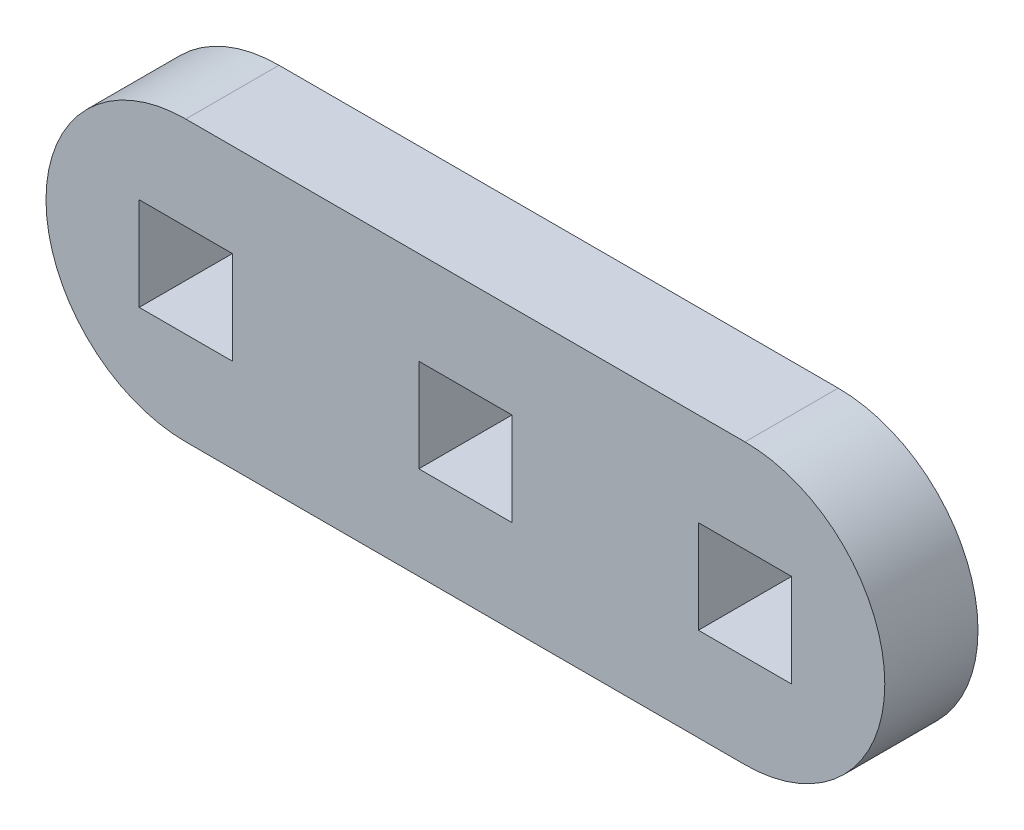
from build123d import *

# Parameters (mm, degrees)
MODEL_W                 = 3
MODEL_H                 = 3
SALIENTE_EXTRUIR1_DEPTH = 3


with BuildPart() as part:
    # Model → Saliente-Extruir1 (new body)
    with BuildSketch(Plane.XY):
        with BuildLine():
            Line((12.437380241, 299.545342772), (30.437380241, 299.545342772))
            ThreePointArc((30.437380241, 299.545342772), (34.937380241, 295.045342772), (30.437380241, 290.545342772))
            Line((30.437380241, 290.545342772), (12.437380241, 290.545342772))
            ThreePointArc((12.437380241, 290.545342772), (7.937380241, 295.045342772), (12.437380241, 299.545342772))
        make_face()
        with Locations((12.437380241, 295.045342772)):
            Rectangle(MODEL_W, MODEL_H, mode=Mode.SUBTRACT)
        with Locations((21.437380241, 295.045342772)):
            Rectangle(MODEL_W, MODEL_H, mode=Mode.SUBTRACT)
        with Locations((30.437380241, 295.045342772)):
            Rectangle(MODEL_W, MODEL_H, mode=Mode.SUBTRACT)
    extrude(amount=SALIENTE_EXTRUIR1_DEPTH)


solid = part.part
